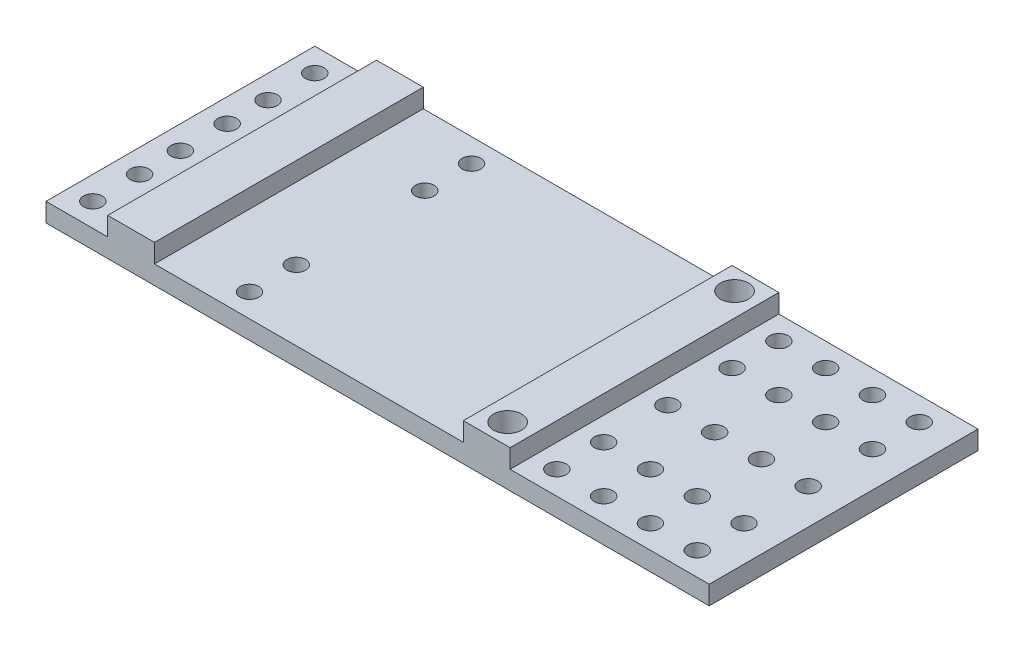
from build123d import *

# Parameters (mm, degrees)
SKETCH1_W          = 141.75
SKETCH1_H          = 57.45
SKETCH1_R          = 2
PLATE2BASE_DEPTH   = 4
SKETCH3_W          = 10
SKETCH3_H          = 57.45
PIBASE_DEPTH       = 4
SKETCH4_R          = 3
PIMOUNT_DEPTH      = 22
SKETCH5_R          = 2
CUT_EXTRUDE2_DEPTH = 4
SKETCH6_R          = 2
CAMMOUNT_DEPTH     = 4


with BuildPart() as part:
    # Sketch1 → Plate2BAse (new body)
    with BuildSketch(Plane(origin=(0, 0, 0), x_dir=(1, 0, 0), z_dir=(0, 1, 0))):
        with Locations((-36.26925, -9.048375)):
            Rectangle(SKETCH1_W, SKETCH1_H)
        with Locations(Location((-102.14425, 14.676625, 0), (0, 0, 270))):
            Circle(SKETCH1_R, mode=Mode.SUBTRACT)
        with Locations(Location((-68.64425, 14.676625, 0), (0, 0, 270))):
            Circle(SKETCH1_R, mode=Mode.SUBTRACT)
        with Locations(Location((-68.64425, 4.676625, 0), (0, 0, 270))):
            Circle(SKETCH1_R, mode=Mode.SUBTRACT)
        with Locations(Location((-102.14425, 4.676625, 0), (0, 0, 270))):
            Circle(SKETCH1_R, mode=Mode.SUBTRACT)
        with Locations(Location((-102.14425, -22.773375, 0), (0, 0, 90))):
            Circle(SKETCH1_R, mode=Mode.SUBTRACT)
        with Locations(Location((-68.64425, -32.773375, 0), (0, 0, 90))):
            Circle(SKETCH1_R, mode=Mode.SUBTRACT)
        with Locations(Location((-68.64425, -22.773375, 0), (0, 0, 90))):
            Circle(SKETCH1_R, mode=Mode.SUBTRACT)
        with Locations(Location((-102.14425, -32.773375, 0), (0, 0, 90))):
            Circle(SKETCH1_R, mode=Mode.SUBTRACT)
    extrude(amount=PLATE2BASE_DEPTH)

    # Sketch3 → PiBase (add)
    with BuildSketch(Plane(origin=(0, 4, 0), x_dir=(1, 0, 0), z_dir=(0, 1, 0))):
        with Locations((-88.955971023, -9.048375)):
            Rectangle(SKETCH3_W, SKETCH3_H)
        with Locations((-12.955971023, -9.048375)):
            Rectangle(SKETCH3_W, SKETCH3_H)
    extrude(amount=PIBASE_DEPTH)

    # Sketch4 → PiMount (cut)
    with BuildSketch(Plane(origin=(0, 8, 0), x_dir=(1, 0, 0), z_dir=(0, 1, 0))):
        with Locations(Location((-12.955971023, 15.201625, 0), (0, 0, 270))):
            Circle(SKETCH4_R)
        with Locations(Location((-12.955971023, -33.298375, 0), (0, 0, 270))):
            Circle(SKETCH4_R)
    extrude(amount=-PIMOUNT_DEPTH, mode=Mode.SUBTRACT)

    # Sketch5 → Cut-Extrude2 (cut)
    with BuildSketch(Plane(origin=(0, 4, 0), x_dir=(1, 0, 0), z_dir=(0, 1, 0))):
        with Locations(Location((-2.955971023, 14.676625, 0), (0, 0, 270))):
            Circle(SKETCH5_R)
        with Locations(Location((7.044028977, 14.676625, 0), (0, 0, 270))):
            Circle(SKETCH5_R)
        with Locations(Location((17.044028977, 14.676625, 0), (0, 0, 270))):
            Circle(SKETCH5_R)
        with Locations(Location((27.044028977, 14.676625, 0), (0, 0, 270))):
            Circle(SKETCH5_R)
        with Locations(Location((7.044028977, 4.676625, 0), (0, 0, 270))):
            Circle(SKETCH5_R)
        with Locations(Location((17.044028977, 4.676625, 0), (0, 0, 270))):
            Circle(SKETCH5_R)
        with Locations(Location((27.044028977, 4.676625, 0), (0, 0, 270))):
            Circle(SKETCH5_R)
        with Locations(Location((-2.955971023, 4.676625, 0), (0, 0, 270))):
            Circle(SKETCH5_R)
        with Locations(Location((-2.955971023, -22.773375, 0), (0, 0, 90))):
            Circle(SKETCH5_R)
        with Locations(Location((27.044028977, -22.773375, 0), (0, 0, 90))):
            Circle(SKETCH5_R)
        with Locations(Location((17.044028977, -22.773375, 0), (0, 0, 90))):
            Circle(SKETCH5_R)
        with Locations(Location((7.044028977, -22.773375, 0), (0, 0, 90))):
            Circle(SKETCH5_R)
        with Locations(Location((27.044028977, -32.773375, 0), (0, 0, 90))):
            Circle(SKETCH5_R)
        with Locations(Location((17.044028977, -32.773375, 0), (0, 0, 90))):
            Circle(SKETCH5_R)
        with Locations(Location((7.044028977, -32.773375, 0), (0, 0, 90))):
            Circle(SKETCH5_R)
        with Locations(Location((-2.955971023, -32.773375, 0), (0, 0, 90))):
            Circle(SKETCH5_R)
        with Locations(Location((-2.955971023, -9.048375, 0), (0, 0, 270))):
            Circle(SKETCH5_R)
        with Locations(Location((7.044028977, -9.048375, 0), (0, 0, 270))):
            Circle(SKETCH5_R)
        with Locations(Location((17.044028977, -9.048375, 0), (0, 0, 270))):
            Circle(SKETCH5_R)
        with Locations(Location((27.044028977, -9.048375, 0), (0, 0, 270))):
            Circle(SKETCH5_R)
    extrude(amount=-CUT_EXTRUDE2_DEPTH, mode=Mode.SUBTRACT)

    # Sketch6 → CamMount (cut)
    with BuildSketch(Plane(origin=(0, 4, 0), x_dir=(1, 0, 0), z_dir=(0, 1, 0))):
        with Locations(Location((-102.14425, -4.048375, 0), (0, 0, 270))):
            Circle(SKETCH6_R)
        with Locations(Location((-102.14425, -14.048375, 0), (0, 0, 90))):
            Circle(SKETCH6_R)
    extrude(amount=-CAMMOUNT_DEPTH, mode=Mode.SUBTRACT)


solid = part.part
